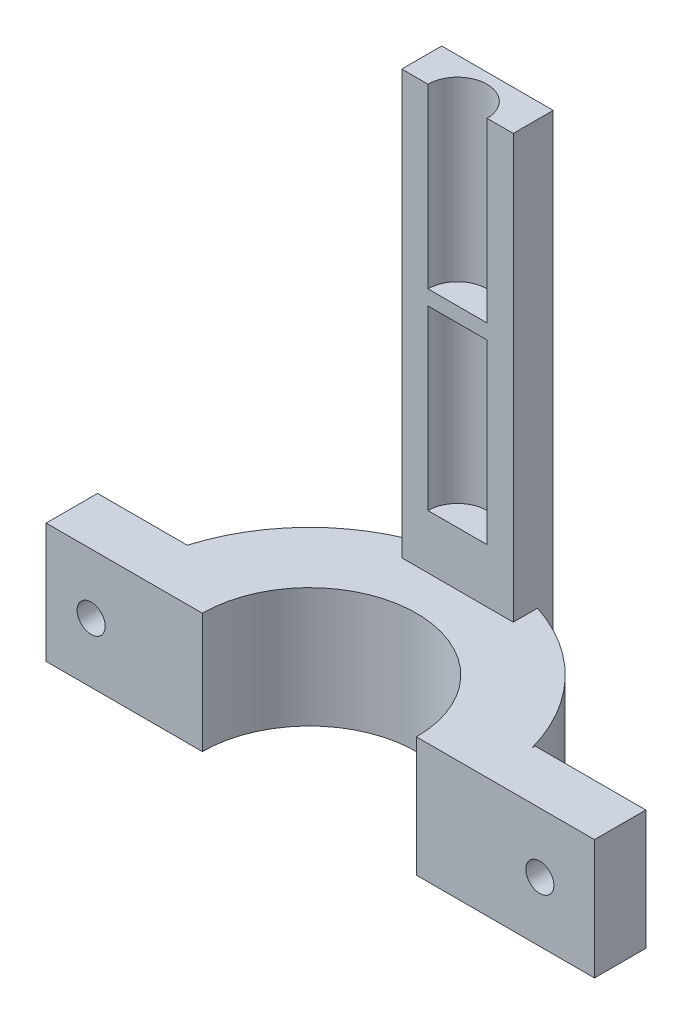
from build123d import *

# Parameters (mm, degrees)
SKETCH_1_W                = 48.51
SKETCH_1_H                = 34
SKETCH_1_W_2              = 28.51
SKETCH_1_H_2              = 14
EXTRUDE_1_DEPTH           = 12.25
SKETCH_2_R                = 1.91
CUT_EXTRUDE_1_DEPTH       = 33.05257439
SKETCH_4_W                = 13
SKETCH_4_H                = 13.91
EXTRUDE_1_2_DEPTH         = 74.82
SKETCH_5_W                = 13.91
SKETCH_5_H                = 16.23
EXTRUDE_2_DEPTH           = 15
SKETCH_7_R                = 24.5
SKETCH_7_R_2              = 14.5
EXTRUDE_2_2_DEPTH         = 16.23
SKETCH_12_R               = 1.9
CUT_EXTRUDE_4_DEPTH       = 97.312124675
EXTRUDE_3_DEPTH           = 10
EXTRUDE_3_DEPTH_BACK      = 8
SKETCH_13_W               = 13.91
SKETCH_13_H               = 16.23
SKETCH_14_R               = 1.9
CUT_EXTRUDE_5_DEPTH       = 103.744583434
SKETCH_16_W               = 90.709398763
SKETCH_16_H               = 28.955068616
CUT_EXTRUDE_7_DEPTH       = 111.229011154
SKETCH_18_W               = 13
SKETCH_18_H               = 93.080932143
CUT_EXTRUDE_10_DEPTH      = 27
CUT_EXTRUDE_11_DEPTH      = 57
CUT_EXTRUDE_11_DEPTH_BACK = 27
SKETCH_17_W               = 20.23049449
SKETCH_17_H               = 80.723570055
SKETCH_21_W               = 15.09856282
SKETCH_21_H               = 42.5
EXTRUDE_6_DEPTH           = 10
SKETCH_22_R               = 4.005
CUT_EXTRUDE_12_DEPTH      = 24
SKETCH_23_W               = 15.09856282
SKETCH_23_H               = 4.587452919
CUT_EXTRUDE_13_DEPTH      = 85.439664289
SKETCH_24_W               = 15.09856282
SKETCH_24_H               = 5.412547081
EXTRUDE_8_DEPTH           = 26
SKETCH_25_R               = 4.005
CUT_EXTRUDE_14_DEPTH      = 24


with BuildPart() as part:
    # 草圖1 → Extrude 1 (new body)
    with BuildSketch(Plane(origin=(0, 0, 0), x_dir=(1, 0, 0), z_dir=(0, 1, 0))):
        Rectangle(SKETCH_1_W, SKETCH_1_H)
        Rectangle(SKETCH_1_W_2, SKETCH_1_H_2, mode=Mode.SUBTRACT)
    extrude(amount=EXTRUDE_1_DEPTH)

    # 草圖2 → 除料-伸長1 (cut, through all)
    with BuildSketch(Plane(origin=(0, 12.25, 0), x_dir=(1, 0, 0), z_dir=(0, 1, 0))):
        with Locations(Location((-19.255, 0, 0), (0, 0, 270))):
            Circle(SKETCH_2_R)
        with Locations(Location((19.255, 0, 0), (0, 0, 270))):
            Circle(SKETCH_2_R)
    extrude(amount=-CUT_EXTRUDE_1_DEPTH, mode=Mode.SUBTRACT)

    # 草圖4 → Extrude 1 2 (add)
    with BuildSketch(Plane.XZ):
        with Locations((17.755, 0)):
            Rectangle(SKETCH_4_W, SKETCH_4_H)
    extrude(amount=EXTRUDE_1_2_DEPTH)

    # 草圖5 → Extrude 2 (add)
    with BuildSketch(Plane.ZY.offset(-11.255)):
        with Locations((0, -66.705)):
            Rectangle(SKETCH_5_W, SKETCH_5_H)
    extrude(amount=EXTRUDE_2_DEPTH)

    # 草圖7 → Extrude 2 2 (add)
    with BuildSketch(Plane(origin=(3.626674765, -74.82, 0), x_dir=(1, 0, 0), z_dir=(0, -1, 0))):
        with Locations((-30.978154344, 0)):
            Circle(SKETCH_7_R)
        with Locations((-30.978154344, 0)):
            Circle(SKETCH_7_R_2, mode=Mode.SUBTRACT)
    extrude(amount=-EXTRUDE_2_2_DEPTH)

    # 草圖12 → 除料-伸長4 (cut, through all)
    with BuildSketch(Plane(origin=(0, 0, -6.955), x_dir=(-1, 0, 0), z_dir=(0, 0, -1))):
        with Locations((-3.856713649, -66.705)):
            Circle(SKETCH_12_R)
    extrude(amount=-CUT_EXTRUDE_4_DEPTH, mode=Mode.SUBTRACT)

    # 草圖13 → 填料-伸長3 (add, two sides: drawn at the far end of the back side and taken through both)
    with BuildSketch(Plane(origin=(-55, 0, 0), x_dir=(0, 0, -1), z_dir=(1, 0, 0)).offset(-EXTRUDE_3_DEPTH_BACK)):
        with Locations((0, -66.705)):
            Rectangle(SKETCH_13_W, SKETCH_13_H)
    extrude(amount=EXTRUDE_3_DEPTH + EXTRUDE_3_DEPTH_BACK)

    # 草圖14 → 除料-伸長5 (cut, through all)
    with BuildSketch(Plane(origin=(0, 0, -6.955), x_dir=(-1, 0, 0), z_dir=(0, 0, -1))):
        with Locations((56.908040017, -66.705)):
            Circle(SKETCH_14_R)
    extrude(amount=-CUT_EXTRUDE_5_DEPTH, mode=Mode.SUBTRACT)

    # 草圖16 → 除料-伸長7 (cut, through all)
    with BuildSketch(Plane(origin=(0, 12.25, 0), x_dir=(1, 0, 0), z_dir=(0, 1, 0))):
        with Locations((-17.645300619, -14.477534308)):
            Rectangle(SKETCH_16_W, SKETCH_16_H)
    extrude(amount=-CUT_EXTRUDE_7_DEPTH, mode=Mode.SUBTRACT)

    # 草圖18 → 除料-伸長10 (cut)
    with BuildSketch(Plane.XY):
        with Locations((17.755, -28.279533929)):
            Rectangle(SKETCH_18_W, SKETCH_18_H)
    extrude(amount=-CUT_EXTRUDE_10_DEPTH, mode=Mode.SUBTRACT)


with BuildPart() as cut_extrude_10_piece_1:
    # of the separate pieces the step leaves, piece 1, a body of its own (cut_extrude_10_pieces)
    add(part.part.solids().sort_by_distance((11.255, -58.59, -6.955))[0])

    # 草圖21 → 填料-伸長6 (add)
    with BuildSketch(Plane.XY.offset(-30)):
        with Locations((-27.29428141, -48.519427919)):
            Rectangle(SKETCH_21_W, SKETCH_21_H)
    extrude(amount=EXTRUDE_6_DEPTH)

    # 草圖22 → 除料-伸長12 (cut)
    with BuildSketch(Plane(origin=(0, -27.269427919, 0), x_dir=(1, 0, 0), z_dir=(0, 1, 0))):
        with Locations((-27.29428141, 20)):
            Circle(SKETCH_22_R)
    extrude(amount=-CUT_EXTRUDE_12_DEPTH, mode=Mode.SUBTRACT)

    # 草圖23 → 除料-伸長13 (cut, through all)
    with BuildSketch(Plane(origin=(0, -27.269427919, 0), x_dir=(1, 0, 0), z_dir=(0, 1, 0))):
        with Locations((-27.29428141, 27.706273541)):
            Rectangle(SKETCH_23_W, SKETCH_23_H)
    extrude(amount=-CUT_EXTRUDE_13_DEPTH, mode=Mode.SUBTRACT)

    # 草圖24 → 填料-伸長8 (add)
    with BuildSketch(Plane(origin=(0, -27.269427919, 0), x_dir=(1, 0, 0), z_dir=(0, 1, 0))):
        with Locations((-27.29428141, 22.70627354)):
            Rectangle(SKETCH_24_W, SKETCH_24_H)
    extrude(amount=EXTRUDE_8_DEPTH)

    # 草圖25 → 除料-伸長14 (cut)
    with BuildSketch(Plane(origin=(0, -1.269427919, 0), x_dir=(1, 0, 0), z_dir=(0, 1, 0))):
        with Locations((-27.29428141, 20)):
            Circle(SKETCH_25_R)
    extrude(amount=-CUT_EXTRUDE_14_DEPTH, mode=Mode.SUBTRACT)


with BuildPart() as cut_extrude_10_piece_2:
    # of the separate pieces the step leaves, piece 2, a body of its own (cut_extrude_10_pieces)
    add(part.part.solids().sort_by_distance((-17.345, 0, 0))[0])

    # 草圖17 → 除料-伸長11 (cut, two sides: drawn at the far end of the back side and taken through both)
    with BuildSketch(Plane.ZY.offset(-11.255).offset(-CUT_EXTRUDE_11_DEPTH_BACK)):
        with Locations((-10.115247245, -18.228214973)):
            Rectangle(SKETCH_17_W, SKETCH_17_H)
    extrude(amount=CUT_EXTRUDE_11_DEPTH + CUT_EXTRUDE_11_DEPTH_BACK, mode=Mode.SUBTRACT)


solid = cut_extrude_10_piece_1.part
